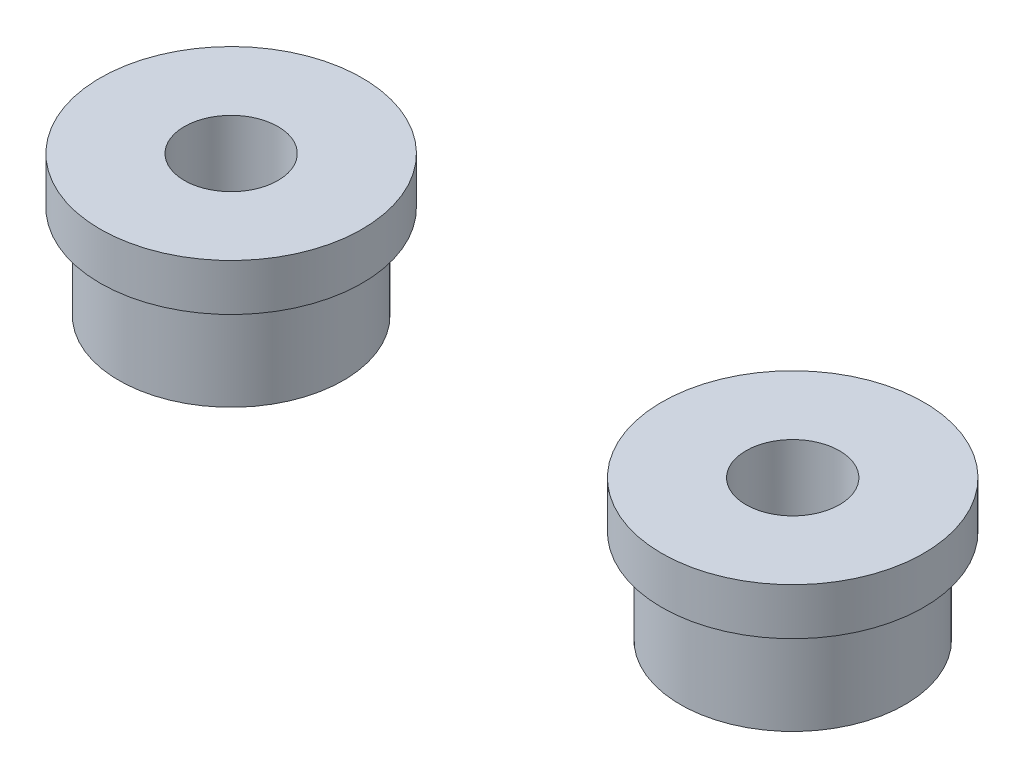
from build123d import *

# Parameters (mm, degrees)
SKETCH3_R           = 7
SKETCH3_R_2         = 2.5
BOSS_EXTRUDE2_DEPTH = 2.5
SKETCH4_R           = 7
SKETCH4_R_2         = 2.5
BOSS_EXTRUDE3_DEPTH = 2.5
BOSS_EXTRUDE4_START = 5
SKETCH5_R           = 6
SKETCH5_R_2         = 2.5
BOSS_EXTRUDE4_DEPTH = 5


with BuildPart() as part:
    # Sketch3 → Boss-Extrude2 (new body)
    with BuildSketch(Plane(origin=(0, 0, 0), x_dir=(1, 0, 0), z_dir=(0, 1, 0))):
        with Locations((-15, 0)):
            Circle(SKETCH3_R)
        with Locations((-15, 0)):
            Circle(SKETCH3_R_2, mode=Mode.SUBTRACT)
    extrude(amount=BOSS_EXTRUDE2_DEPTH)



with BuildPart() as body_2:
    # Sketch4 → Boss-Extrude3 (new body)
    with BuildSketch(Plane(origin=(0, 0, 0), x_dir=(1, 0, 0), z_dir=(0, 1, 0))):
        with Locations((15, 0)):
            Circle(SKETCH4_R)
        with Locations((15, 0)):
            Circle(SKETCH4_R_2, mode=Mode.SUBTRACT)
    extrude(amount=BOSS_EXTRUDE3_DEPTH)


with BuildPart() as part_1:
    add(part.part)

    add(body_2.part)  # Boss-Extrude4 merges body 2
    # Sketch5 → Boss-Extrude4 (add)
    # profile 1 of 2: a face of its own
    with BuildSketch(Plane.XZ.offset(BOSS_EXTRUDE4_START)):
        with Locations((15, 0)):
            Circle(SKETCH5_R)
        with Locations((15, 0)):
            Circle(SKETCH5_R_2, mode=Mode.SUBTRACT)
    # profile 2 of 2: a face of its own
    with BuildSketch(Plane.XZ.offset(BOSS_EXTRUDE4_START)):
        with Locations((-15, 0)):
            Circle(SKETCH5_R)
        with Locations((-15, 0)):
            Circle(SKETCH5_R_2, mode=Mode.SUBTRACT)
    extrude(amount=-BOSS_EXTRUDE4_DEPTH)


solid = part_1.part
